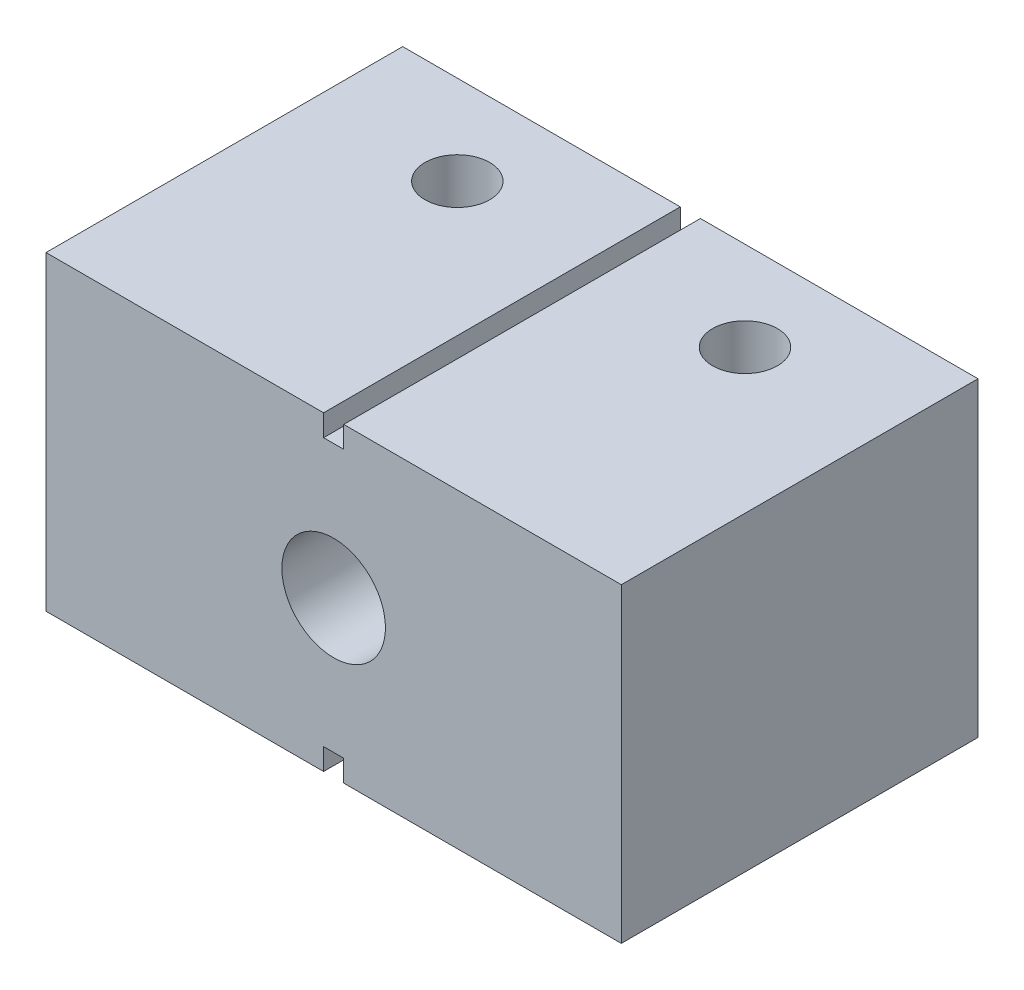
from build123d import *

# Parameters (mm, degrees)
SKETCH1_W           = 40
SKETCH1_H           = 21.6
SKETCH1_R           = 3.6
BOSS_EXTRUDE1_DEPTH = 24.8
CUT_EXTRUDE1_REACH  = 40.492
SKETCH2_R           = 2.25
SKETCH3_W           = 1.4
SKETCH3_H           = 24.8
CUT_EXTRUDE2_DEPTH  = 1.5
SKETCH4_W           = 1.4
SKETCH4_H           = 24.8
CUT_EXTRUDE3_DEPTH  = 1.5
CUT_EXTRUDE4_DEPTH  = 1.2


with BuildPart() as part:
    # Sketch1 → Boss-Extrude1 (new body)
    with BuildSketch(Plane.XY):
        Rectangle(SKETCH1_W, SKETCH1_H)
        with Locations(Location((0, 0, 0), (0, 0, 180))):
            Circle(SKETCH1_R, mode=Mode.SUBTRACT)
    extrude(amount=BOSS_EXTRUDE1_DEPTH)

    # Sketch2 → Cut-Extrude1 (cut, up to next)
    with BuildSketch(Plane(origin=(0, 10.8, 0), x_dir=(1, 0, 0), z_dir=(0, 1, 0)), mode=Mode.PRIVATE) as cut_extrude1_sk1:
        with Locations(Location((-10, -6.2, 0), (0, 0, 270))):
            Circle(SKETCH2_R)
    cut_extrude1_tool1 = extrude(cut_extrude1_sk1.sketch, amount=-CUT_EXTRUDE1_REACH, mode=Mode.PRIVATE) & part.part
    # Sketch2 → Cut-Extrude1 (cut, up to next)
    with BuildSketch(Plane(origin=(0, 10.8, 0), x_dir=(1, 0, 0), z_dir=(0, 1, 0)), mode=Mode.PRIVATE) as cut_extrude1_sk2:
        with Locations(Location((10, -6.2, 0), (0, 0, 270))):
            Circle(SKETCH2_R)
    cut_extrude1_tool2 = extrude(cut_extrude1_sk2.sketch, amount=-CUT_EXTRUDE1_REACH, mode=Mode.PRIVATE) & part.part
    add(cut_extrude1_tool1.solids().sort_by_distance((-10, 10.8, 6.2))[0], mode=Mode.SUBTRACT)
    add(cut_extrude1_tool2.solids().sort_by_distance((10, 10.8, 6.2))[0], mode=Mode.SUBTRACT)

    # Sketch3 → Cut-Extrude2 (cut)
    with BuildSketch(Plane(origin=(0, 10.8, 0), x_dir=(1, 0, 0), z_dir=(0, 1, 0))):
        with Locations((0, -12.4)):
            Rectangle(SKETCH3_W, SKETCH3_H)
    extrude(amount=-CUT_EXTRUDE2_DEPTH, mode=Mode.SUBTRACT)

    # Sketch4 → Cut-Extrude3 (cut)
    with BuildSketch(Plane.XZ.offset(10.8)):
        with Locations((0, 12.4)):
            Rectangle(SKETCH4_W, SKETCH4_H)
    extrude(amount=-CUT_EXTRUDE3_DEPTH, mode=Mode.SUBTRACT)

    # Sketch5 → Cut-Extrude4 (cut)
    # profile 1 of 2: a face of its own
    with BuildSketch(Plane(origin=(0, 0, 0), x_dir=(-1, 0, 0), z_dir=(0, 0, -1))):
        Polygon((-16.835493456, 3.808333333), (-15.223824786, 3.808333333), (-15.223824786, -3.6), (-16.173611111, -3.6), (-16.173611111, 2.953525641), (-17.313354701, 2.953525641), align=None)
    # profile 2 of 2: a face of its own
    with BuildSketch(Plane(origin=(0, 0, 0), x_dir=(-1, 0, 0), z_dir=(0, 0, -1))):
        with BuildLine():
            add(Edge.make_bspline(
                [(-8.848384081, 0.47517695), (-8.791720329, 0.448011314), (-8.6805447, 0.394711692), (-8.521240972, 0.306999356), (-8.373059041, 0.213852669), (-8.235445359, 0.115022941), (-8.10774427, 0.011871653), (-7.991328458, -0.098049317), (-7.887760339, -0.214982628), (-7.791993555, -0.334289788), (-7.709318901, -0.459622132), (-7.63582703, -0.587726493), (-7.573476695, -0.719597183), (-7.522658909, -0.855077799), (-7.484401457, -0.993797089), (-7.455690091, -1.135022012), (-7.439295513, -1.280057203), (-7.436826686, -1.37785624), (-7.435576923, -1.427363782)],
                knots=[0, 0, 0, 0, 1.199852352, 2.35413882, 3.47065844, 4.540274002, 5.587801972, 6.603495342, 7.593560922, 8.568777743, 9.522481312, 10.457521451, 11.387201504, 12.30490139, 13.21713931, 14.132356092, 15.05456678, 16, 16, 16, 16], degree=3))
            add(Edge.make_bspline(
                [(-7.435576923, -1.427363782), (-7.437162422, -1.497207933), (-7.440312907, -1.63599266), (-7.469501587, -1.841772102), (-7.517305252, -2.042772476), (-7.582685607, -2.239008764), (-7.666392716, -2.431147474), (-7.770790548, -2.61726867), (-7.892699429, -2.799625955), (-7.986178203, -2.914114711), (-8.033645499, -2.972250601)],
                knots=[0, 0, 0, 0, 0.989668167, 1.966532972, 2.939463265, 3.915194743, 4.894949873, 5.905734453, 6.936559411, 8, 8, 8, 8], degree=3))
            add(Edge.make_bspline(
                [(-8.033645499, -2.972250601), (-8.093809056, -3.037820884), (-8.214022321, -3.16883737), (-8.424621016, -3.333999827), (-8.652745136, -3.477097199), (-8.903819023, -3.591041471), (-9.174610962, -3.682090913), (-9.466799089, -3.745020808), (-9.779400673, -3.782149996), (-9.994453663, -3.787300764), (-10.10536692, -3.789957265)],
                knots=[0, 0, 0, 0, 0.926996352, 1.852238525, 2.781645049, 3.73067391, 4.721265738, 5.756811539, 6.843078903, 8, 8, 8, 8], degree=3))
            add(Edge.make_bspline(
                [(-10.10536692, -3.789957265), (-10.206856077, -3.787526788), (-10.403947682, -3.782806811), (-10.690247065, -3.750707914), (-10.957512241, -3.694124208), (-11.206459982, -3.615970215), (-11.436623966, -3.514791583), (-11.648218464, -3.390783772), (-11.840136691, -3.243196306), (-12.012012377, -3.075045738), (-12.162180876, -2.893457299), (-12.296265312, -2.707418448), (-12.407788251, -2.515430425), (-12.498791009, -2.318513964), (-12.570260066, -2.117320275), (-12.623367356, -1.911474171), (-12.652901952, -1.700301444), (-12.657231267, -1.558044155), (-12.659401709, -1.486725427)],
                knots=[0, 0, 0, 0, 1.265004079, 2.45663372, 3.584954987, 4.665300477, 5.703324836, 6.712186938, 7.714849438, 8.713389218, 9.702614074, 10.648777578, 11.568864218, 12.465490505, 13.348959921, 14.226816935, 15.111039146, 16, 16, 16, 16], degree=3))
            add(Edge.make_bspline(
                [(-12.659401709, -1.486725427), (-12.658152087, -1.434251671), (-12.655682173, -1.330535788), (-12.639267914, -1.176637821), (-12.610765256, -1.026965427), (-12.572527834, -0.880833781), (-12.521913677, -0.739291961), (-12.458727174, -0.60239444), (-12.38624716, -0.468768269), (-12.302772358, -0.339049846), (-12.208257902, -0.214315959), (-12.100393396, -0.096731391), (-11.981263755, 0.014805914), (-11.850796349, 0.119945437), (-11.70875469, 0.21829611), (-11.555463223, 0.310236199), (-11.39087154, 0.396344688), (-11.275582224, 0.447606678), (-11.216913729, 0.473692909)],
                knots=[0, 0, 0, 0, 0.970985163, 1.919180014, 2.85992262, 3.788021587, 4.711640783, 5.637389442, 6.575411522, 7.522501122, 8.489161933, 9.467583092, 10.471367105, 11.506385571, 12.565254043, 13.665720306, 14.81213038, 16, 16, 16, 16], degree=3))
            add(Edge.make_bspline(
                [(-11.216913729, 0.473692909), (-11.297360803, 0.509335), (-11.455090039, 0.579216968), (-11.667175949, 0.724983349), (-11.851133005, 0.898377122), (-12.005521504, 1.097386182), (-12.126349991, 1.315304583), (-12.215070166, 1.543786324), (-12.269119921, 1.781600037), (-12.276013058, 1.943113546), (-12.279487179, 2.024515892)],
                knots=[0, 0, 0, 0, 1.055820553, 2.070103492, 3.075423004, 4.084025502, 5.08490385, 6.059961771, 7.022226287, 8, 8, 8, 8], degree=3))
            add(Edge.make_bspline(
                [(-12.279487179, 2.024515892), (-12.276180515, 2.107434425), (-12.269553531, 2.273613899), (-12.211437591, 2.520087551), (-12.118482685, 2.761847489), (-11.990664725, 2.996641168), (-11.83272563, 3.219008216), (-11.639633108, 3.415630841), (-11.421456047, 3.589673476), (-11.176967219, 3.735359367), (-10.914115075, 3.851746415), (-10.63894204, 3.937257818), (-10.353211099, 3.989486436), (-10.159010805, 3.995334497), (-10.060845686, 3.998290598)],
                knots=[0, 0, 0, 0, 0.906232073, 1.81620639, 2.755067393, 3.733488311, 4.733923586, 5.729132781, 6.738430927, 7.779927963, 8.833993065, 9.876600597, 10.92665582, 12, 12, 12, 12], degree=3))
            add(Edge.make_bspline(
                [(-10.060845686, 3.998290598), (-9.958203869, 3.994999131), (-9.755940575, 3.98851305), (-9.459255538, 3.933030684), (-9.175020506, 3.843760065), (-8.906445922, 3.719584747), (-8.659653402, 3.56588911), (-8.439461925, 3.388796981), (-8.249496339, 3.18828115), (-8.09592535, 2.965213553), (-7.970206403, 2.732845376), (-7.882640345, 2.492720741), (-7.82572466, 2.250273988), (-7.81889209, 2.086657084), (-7.815491453, 2.005223357)],
                knots=[0, 0, 0, 0, 1.110268248, 2.187865701, 3.254767133, 4.328098968, 5.381545701, 6.394263667, 7.379165353, 8.359588233, 9.317751921, 10.230884237, 11.119493861, 12, 12, 12, 12], degree=3))
            add(Edge.make_bspline(
                [(-7.815491453, 2.005223357), (-7.819049828, 1.924825476), (-7.826062852, 1.766373316), (-7.877921982, 1.53422783), (-7.965285741, 1.313837246), (-8.086130663, 1.106473113), (-8.235707987, 0.914373454), (-8.414916442, 0.744819084), (-8.617957614, 0.593031274), (-8.770403467, 0.515061051), (-8.848384081, 0.47517695)],
                knots=[0, 0, 0, 0, 0.988899786, 1.948973104, 2.910993775, 3.895630921, 4.893001336, 5.896206921, 6.923846912, 8, 8, 8, 8], degree=3))
        make_face()
        with BuildLine():
            add(Edge.make_bspline(
                [(-10.097946715, 3.143482906), (-10.140033864, 3.142740783), (-10.222998083, 3.141277875), (-10.344788927, 3.126351383), (-10.461649024, 3.100288998), (-10.574394338, 3.067128167), (-10.681450658, 3.022066707), (-10.783698718, 2.967867378), (-10.881664324, 2.904557776), (-10.972369667, 2.830612175), (-11.055989005, 2.750807165), (-11.129164318, 2.664264798), (-11.191136097, 2.572628354), (-11.242951654, 2.476525743), (-11.281202169, 2.374495387), (-11.309687195, 2.267705667), (-11.326000494, 2.155609241), (-11.328455173, 2.079475917), (-11.329700855, 2.040840345)],
                knots=[0, 0, 0, 0, 1.095241603, 2.158993112, 3.186991986, 4.209491771, 5.213911611, 6.204701426, 7.21906016, 8.24471744, 9.246492325, 10.224225466, 11.188553256, 12.121771109, 13.059243777, 14.018139663, 14.994260291, 16, 16, 16, 16], degree=3))
            add(Edge.make_bspline(
                [(-11.329700855, 2.040840345), (-11.328548922, 2.001704583), (-11.326276507, 1.924501566), (-11.308546728, 1.810688894), (-11.276136226, 1.701829467), (-11.235039491, 1.595236277), (-11.180037494, 1.493189875), (-11.11200384, 1.395843297), (-11.032845815, 1.302155006), (-10.943823492, 1.212906537), (-10.84629275, 1.131632175), (-10.743979938, 1.061036454), (-10.640028424, 0.998958442), (-10.532222461, 0.950273021), (-10.421836423, 0.910556901), (-10.30761143, 0.884854833), (-10.190972173, 0.867588676), (-10.112355139, 0.865200032), (-10.072718015, 0.863995726)],
                knots=[0, 0, 0, 0, 0.988034692, 1.949093513, 2.89789864, 3.851215077, 4.829171163, 5.816653019, 6.845000524, 7.922541884, 8.995658004, 10.045551389, 11.058844434, 12.048141588, 13.027850999, 14.015569822, 14.999490322, 16, 16, 16, 16], degree=3))
            add(Edge.make_bspline(
                [(-10.072718015, 0.863995726), (-10.015697335, 0.866014707), (-9.901793602, 0.870047796), (-9.734069665, 0.901879798), (-9.571389794, 0.954987396), (-9.415641067, 1.026721046), (-9.270632904, 1.117020379), (-9.139727414, 1.222583441), (-9.028109864, 1.345337803), (-8.935016984, 1.480737478), (-8.860101756, 1.622249092), (-8.805826931, 1.766811121), (-8.771192911, 1.91107685), (-8.76722782, 2.00800917), (-8.765277778, 2.055680756)],
                knots=[0, 0, 0, 0, 1.049117758, 2.095703322, 3.12949479, 4.192860745, 5.243991977, 6.266533316, 7.278437116, 8.286276617, 9.284194569, 10.217805671, 11.123511861, 12, 12, 12, 12], degree=3))
            add(Edge.make_bspline(
                [(-8.765277778, 2.055680756), (-8.769068282, 2.122028527), (-8.776659131, 2.254896345), (-8.845994907, 2.447999505), (-8.953383358, 2.632924484), (-9.07526074, 2.775931697), (-9.19195509, 2.881446684), (-9.290911721, 2.953745753), (-9.40265735, 3.010282893), (-9.521931186, 3.061206491), (-9.652680692, 3.095923839), (-9.791985254, 3.12627924), (-9.941886442, 3.139225482), (-10.045006855, 3.142038673), (-10.097946715, 3.143482906)],
                knots=[0, 0, 0, 0, 1.241338669, 2.485900565, 3.804153544, 5.239850267, 5.989116827, 6.754143574, 7.530572576, 8.333835511, 9.182981957, 10.064047481, 11.006122539, 12, 12, 12, 12], degree=3))
        make_face(mode=Mode.SUBTRACT)
        with BuildLine():
            add(Edge.make_bspline(
                [(-10.056393563, 0.009188034), (-10.111863822, 0.007681931), (-10.221707841, 0.004699496), (-10.383102122, -0.016552559), (-10.538862331, -0.050262227), (-10.688391038, -0.099914708), (-10.832062544, -0.163493056), (-10.969385939, -0.241525618), (-11.10106559, -0.332282159), (-11.223645326, -0.43728547), (-11.338469676, -0.549652704), (-11.435521686, -0.672811157), (-11.522373496, -0.79875589), (-11.589580038, -0.933186105), (-11.644915953, -1.072290223), (-11.680220621, -1.218302175), (-11.706179258, -1.369558648), (-11.708455957, -1.472756267), (-11.709615385, -1.525310497)],
                knots=[0, 0, 0, 0, 1.061737162, 2.102486608, 3.111202598, 4.10847281, 5.113313649, 6.114129921, 7.128166648, 8.169777499, 9.201047485, 10.197912915, 11.167134194, 12.124343908, 13.068772331, 14.026590883, 14.995025286, 16, 16, 16, 16], degree=3))
            add(Edge.make_bspline(
                [(-11.709615385, -1.525310497), (-11.707202063, -1.590844398), (-11.702438278, -1.720205296), (-11.659641407, -1.90967481), (-11.595334515, -2.092438338), (-11.501062173, -2.263572655), (-11.385633777, -2.420608727), (-11.251879808, -2.559610731), (-11.099502239, -2.677252434), (-10.929405708, -2.772505491), (-10.74199866, -2.844357314), (-10.540762191, -2.898445972), (-10.323990386, -2.929493674), (-10.174720515, -2.933228595), (-10.097946715, -2.935149573)],
                knots=[0, 0, 0, 0, 0.981329446, 1.937099046, 2.899036353, 3.878120833, 4.854250959, 5.814155872, 6.760671206, 7.730355173, 8.726181162, 9.762479505, 10.849178675, 12, 12, 12, 12], degree=3))
            add(Edge.make_bspline(
                [(-10.097946715, -2.935149573), (-10.033578242, -2.93369098), (-9.907959344, -2.93084445), (-9.725316957, -2.909732122), (-9.552739927, -2.876092647), (-9.390900877, -2.826792863), (-9.238222596, -2.764823476), (-9.096784192, -2.686965201), (-8.965349999, -2.596115663), (-8.845367666, -2.492186908), (-8.738684683, -2.3788747), (-8.643733179, -2.260662939), (-8.563516935, -2.138221811), (-8.498851661, -2.010081665), (-8.448594405, -1.87768505), (-8.410706046, -1.741276021), (-8.389925058, -1.599657305), (-8.386899985, -1.504102438), (-8.385363248, -1.455560564)],
                knots=[0, 0, 0, 0, 1.222281775, 2.385355485, 3.487203028, 4.557186295, 5.593560507, 6.611067706, 7.617058548, 8.622873886, 9.619741804, 10.569077626, 11.499394282, 12.39435997, 13.28947359, 14.185178695, 15.078070757, 16, 16, 16, 16], degree=3))
            add(Edge.make_bspline(
                [(-8.385363248, -1.455560564), (-8.386610442, -1.408943853), (-8.389094868, -1.316082812), (-8.414597737, -1.179516255), (-8.45111108, -1.045740132), (-8.504927707, -0.916101583), (-8.575908831, -0.791000603), (-8.660479217, -0.668951513), (-8.761140867, -0.551441165), (-8.873976651, -0.438482872), (-8.997597421, -0.333549431), (-9.129634983, -0.241382809), (-9.268270052, -0.163675259), (-9.413617357, -0.100959893), (-9.565267794, -0.052190938), (-9.723076553, -0.016205669), (-9.887640133, 0.004721398), (-9.999446288, 0.00768073), (-10.056393563, 0.009188034)],
                knots=[0, 0, 0, 0, 0.909879601, 1.812490977, 2.706051563, 3.616136508, 4.546527019, 5.511811824, 6.513061575, 7.56562502, 8.628742847, 9.677170642, 10.707077332, 11.728786898, 12.7650243, 13.815544189, 14.887370682, 16, 16, 16, 16], degree=3))
        make_face(mode=Mode.SUBTRACT)
    extrude(amount=-CUT_EXTRUDE4_DEPTH, mode=Mode.SUBTRACT)


solid = part.part
